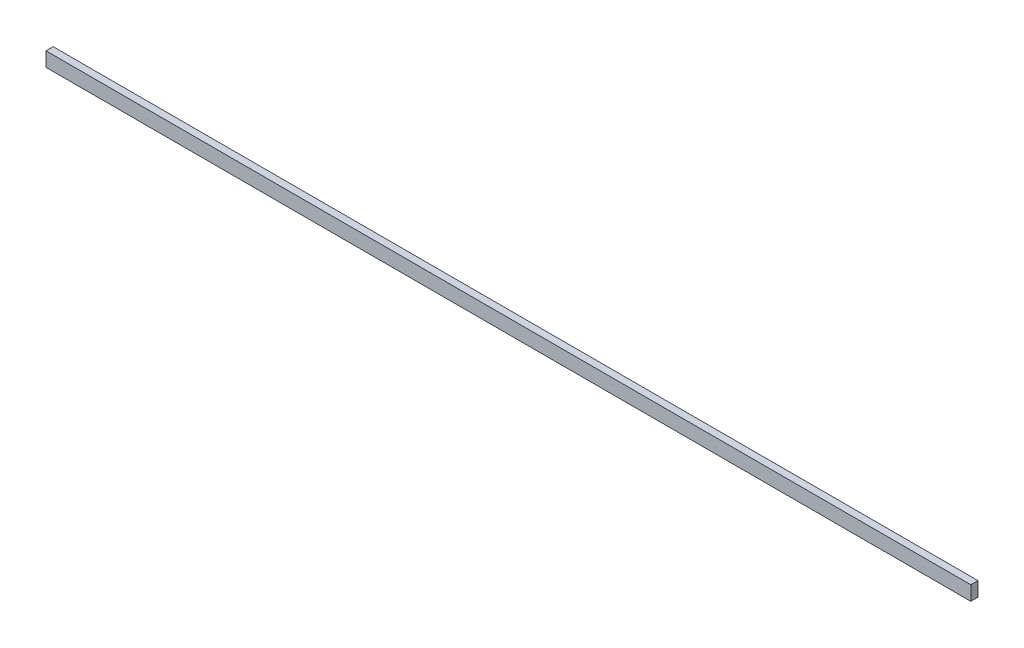
from build123d import *

# Parameters (mm, degrees)
CROQUIS1_W              = 5
CROQUIS1_H              = 10
SALIENTE_EXTRUIR1_DEPTH = 645


with BuildPart() as part:
    # Croquis1 → Saliente-Extruir1 (new body)
    with BuildSketch(Plane(origin=(0, 0, 0), x_dir=(0, 0, -1), z_dir=(1, 0, 0))):
        Rectangle(CROQUIS1_W, CROQUIS1_H)
    extrude(amount=SALIENTE_EXTRUIR1_DEPTH)


solid = part.part
